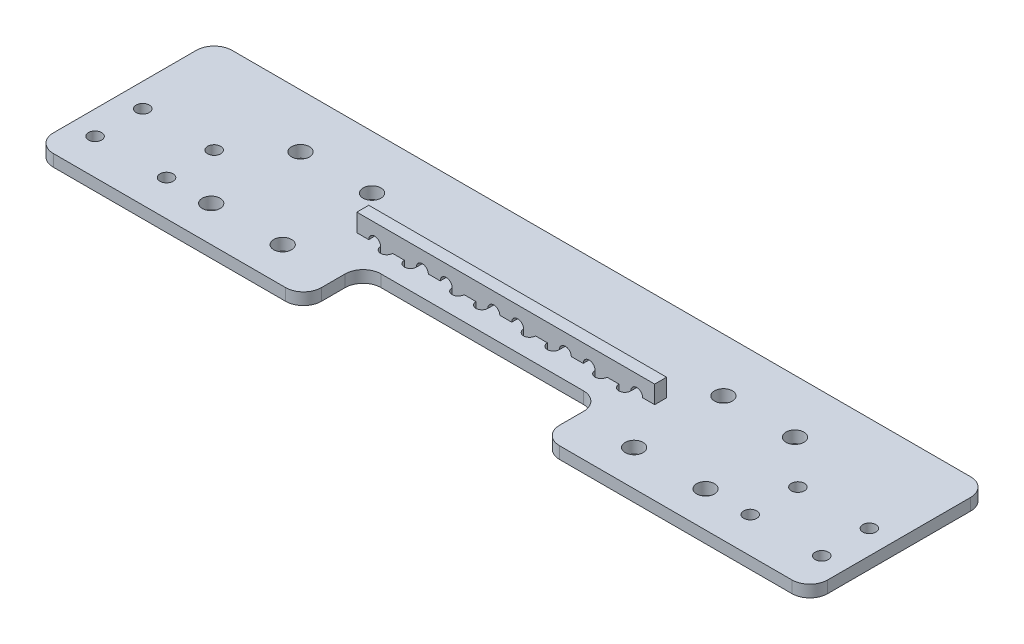
from build123d import *

# Parameters (mm, degrees)
SKETCH_1_W          = 130
SKETCH_1_H          = 30
SKETCH_1_R          = 1.1
EXTRUDE_1_DEPTH     = 2
SKETCH_2_W          = 40
SKETCH_2_H          = 10
CUT_EXTRUDE_1_DEPTH = 134.431630433
FILLET_1_R          = 3
CUT_EXTRUDE_2_DEPTH = 134.431630433
EXTRUDE_4_DEPTH     = 2
SKETCH_8_R          = 1.5
CUT_EXTRUDE_3_DEPTH = 134.510299228


with BuildPart() as part:
    # 草图1 → 凸台-拉伸1 (new body)
    with BuildSketch(Plane(origin=(0, 0, 0), x_dir=(1, 0, 0), z_dir=(0, 1, 0))):
        with Locations((65, 15)):
            Rectangle(SKETCH_1_W, SKETCH_1_H)
        with Locations((4, 14)):
            Circle(SKETCH_1_R, mode=Mode.SUBTRACT)
        with Locations((4, 6)):
            Circle(SKETCH_1_R, mode=Mode.SUBTRACT)
        with Locations((16, 14)):
            Circle(SKETCH_1_R, mode=Mode.SUBTRACT)
        with Locations((16, 6)):
            Circle(SKETCH_1_R, mode=Mode.SUBTRACT)
        with Locations((114, 6)):
            Circle(SKETCH_1_R, mode=Mode.SUBTRACT)
        with Locations((114, 14)):
            Circle(SKETCH_1_R, mode=Mode.SUBTRACT)
        with Locations((126, 14)):
            Circle(SKETCH_1_R, mode=Mode.SUBTRACT)
        with Locations((126, 6)):
            Circle(SKETCH_1_R, mode=Mode.SUBTRACT)
    extrude(amount=EXTRUDE_1_DEPTH)

    # 草图2 → 切除-拉伸1 (cut, through all)
    with BuildSketch(Plane(origin=(0, 2, 0), x_dir=(1, 0, 0), z_dir=(0, 1, 0))):
        with Locations((65, 5)):
            Rectangle(SKETCH_2_W, SKETCH_2_H)
    extrude(amount=-CUT_EXTRUDE_1_DEPTH, mode=Mode.SUBTRACT)

    # 圆角1
    fillet_1_edges = [part.edges().sort_by_distance(p)[0] for p in [
        (85, 1, 0),
        (130, 1, 0),
        (130, 1, -30),
        (85, 1, -10),
        (45, 1, -10),
        (45, 1, 0),
        (0, 1, 0),
        (0, 1, -30),
    ]]
    fillet(fillet_1_edges, radius=FILLET_1_R)

    # 草图6 → 切除-拉伸2 (cut, through all)
    with BuildSketch(Plane(origin=(0, 2, 0), x_dir=(1, 0, 0), z_dir=(0, 1, 0))):
        with BuildLine():
            Line((60, 16.05), (58, 16.05))
            ThreePointArc((58, 16.05), (57, 17.05), (56, 16.05))
            Line((56, 16.05), (56, 13.95))
            ThreePointArc((56, 13.95), (57, 12.95), (58, 13.95))
            Line((58, 13.95), (60, 13.95))
            ThreePointArc((60, 13.95), (61, 12.95), (62, 13.95))
            Line((62, 13.95), (62, 16.05))
            ThreePointArc((62, 16.05), (61, 17.05), (60, 16.05))
        make_face()
        with BuildLine():
            ThreePointArc((46, 16.05), (45, 17.05), (44, 16.05))
            Line((44, 16.05), (44, 13.95))
            ThreePointArc((44, 13.95), (45, 12.95), (46, 13.95))
            Line((46, 13.95), (48, 13.95))
            ThreePointArc((48, 13.95), (49, 12.95), (50, 13.95))
            Line((50, 13.95), (50, 16.05))
            ThreePointArc((50, 16.05), (49, 17.05), (48, 16.05))
            Line((48, 16.05), (46, 16.05))
        make_face()
        with BuildLine():
            Line((72, 16.05), (70, 16.05))
            ThreePointArc((70, 16.05), (69, 17.05), (68, 16.05))
            Line((68, 16.05), (68, 13.95))
            ThreePointArc((68, 13.95), (69, 12.95), (70, 13.95))
            Line((70, 13.95), (72, 13.95))
            ThreePointArc((72, 13.95), (73, 12.95), (74, 13.95))
            Line((74, 13.95), (74, 16.05))
            ThreePointArc((74, 16.05), (73, 17.05), (72, 16.05))
        make_face()
        with BuildLine():
            Line((84, 16.05), (82, 16.05))
            ThreePointArc((82, 16.05), (81, 17.05), (80, 16.05))
            Line((80, 16.05), (80, 13.95))
            ThreePointArc((80, 13.95), (81, 12.95), (82, 13.95))
            Line((82, 13.95), (84, 13.95))
            ThreePointArc((84, 13.95), (85, 12.95), (86, 13.95))
            Line((86, 13.95), (86, 16.05))
            ThreePointArc((86, 16.05), (85, 17.05), (84, 16.05))
        make_face()
    extrude(amount=-CUT_EXTRUDE_2_DEPTH, mode=Mode.SUBTRACT)

    # 草图8 → 切除-拉伸3 (cut, through all)
    with BuildSketch(Plane.XZ):
        with Locations((23.5, -6)):
            Circle(SKETCH_8_R)
        with Locations((23.5, -21)):
            Circle(SKETCH_8_R)
        with Locations((35.5, -21)):
            Circle(SKETCH_8_R)
        with Locations((35.5, -6)):
            Circle(SKETCH_8_R)
        with Locations((94.5, -21)):
            Circle(SKETCH_8_R)
        with Locations((94.5, -6)):
            Circle(SKETCH_8_R)
        with Locations((106.5, -6)):
            Circle(SKETCH_8_R)
        with Locations((106.5, -21)):
            Circle(SKETCH_8_R)
    extrude(amount=-CUT_EXTRUDE_3_DEPTH, mode=Mode.SUBTRACT)


with BuildPart() as body_2:
    # 草图7 → 凸台-拉伸4 (new body)
    with BuildSketch(Plane(origin=(0, 0, -13.95), x_dir=(-1, 0, 0), z_dir=(0, 0, -1))):
        with BuildLine():
            Line((-44, -2), (-44, 2))
            ThreePointArc((-44, 2), (-43, 3), (-42, 2))
            Line((-42, 2), (-40, 2))
            Line((-40, 2), (-40, 5))
            Line((-40, 5), (-90, 5))
            Line((-90, 5), (-90, 2))
            Line((-90, 2), (-88, 2))
            ThreePointArc((-88, 2), (-87, 3), (-86, 2))
            Line((-86, 2), (-86, -2))
            Line((-86, -2), (-80, -2))
            Line((-80, -2), (-80, 2))
            ThreePointArc((-80, 2), (-79, 3), (-78, 2))
            Line((-78, 2), (-76, 2))
            ThreePointArc((-76, 2), (-75, 3), (-74, 2))
            Line((-74, 2), (-74, -2))
            Line((-74, -2), (-68, -2))
            Line((-68, -2), (-68, 2))
            ThreePointArc((-68, 2), (-67, 3), (-66, 2))
            Line((-66, 2), (-64, 2))
            ThreePointArc((-64, 2), (-63, 3), (-62, 2))
            Line((-62, 2), (-62, -2))
            Line((-62, -2), (-56, -2))
            Line((-56, -2), (-56, 2))
            ThreePointArc((-56, 2), (-55, 3), (-54, 2))
            Line((-54, 2), (-52, 2))
            ThreePointArc((-52, 2), (-51, 3), (-50, 2))
            Line((-50, 2), (-50, -2))
            Line((-50, -2), (-44, -2))
        make_face()
    extrude(amount=EXTRUDE_4_DEPTH)


solid = Compound([part.part, body_2.part])
